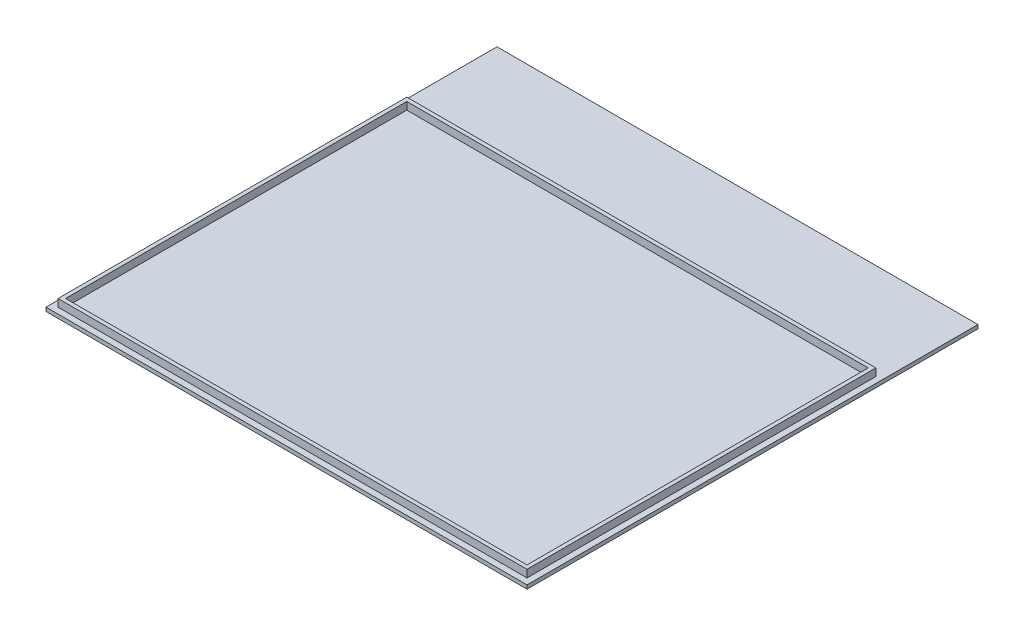
from build123d import *

# Parameters (mm, degrees)
SKETCH1_W           = 203.2
SKETCH1_H           = 152.4
BOSS_EXTRUDE1_DEPTH = 1.5875
SKETCH2_W           = 198.12
SKETCH2_H           = 147.32
BOSS_EXTRUDE2_DEPTH = 3.175
SKETCH3_W           = 194.945
SKETCH3_H           = 144.145
CUT_EXTRUDE1_DEPTH  = 3.175
CUT_EXTRUDE2_DEPTH  = 1
SKETCH5_W           = 203.2
SKETCH5_H           = 1.5875
BOSS_EXTRUDE3_DEPTH = 38.1


with BuildPart() as part:
    # Sketch1 → Boss-Extrude1 (new body)
    with BuildSketch(Plane(origin=(0, 0, 0), x_dir=(1, 0, 0), z_dir=(0, 1, 0))):
        Rectangle(SKETCH1_W, SKETCH1_H)
    extrude(amount=BOSS_EXTRUDE1_DEPTH)

    # Sketch2 → Boss-Extrude2 (add)
    with BuildSketch(Plane(origin=(0, 1.5875, 0), x_dir=(1, 0, 0), z_dir=(0, 1, 0))):
        Rectangle(SKETCH2_W, SKETCH2_H)
    extrude(amount=BOSS_EXTRUDE2_DEPTH)

    # Sketch3 → Cut-Extrude1 (cut)
    with BuildSketch(Plane(origin=(0, 4.7625, 0), x_dir=(1, 0, 0), z_dir=(0, 1, 0))):
        Rectangle(SKETCH3_W, SKETCH3_H)
    extrude(amount=-CUT_EXTRUDE1_DEPTH, mode=Mode.SUBTRACT)

    # Sketch4 → Cut-Extrude2 (cut)
    # profile 1 of 4: a face of its own
    with BuildSketch(Plane.XZ):
        with BuildLine():
            add(Edge.make_bspline(
                [(87.687482338, 63.393037778), (87.544180498, 63.395163571), (87.263013138, 63.399334512), (86.84989298, 63.445259615), (86.45295191, 63.513943675), (86.071785642, 63.613073858), (85.707328729, 63.739904028), (85.358663787, 63.894478976), (85.026714987, 64.077735967), (84.819502101, 64.221838495), (84.715938102, 64.293860243)],
                knots=[0, 0, 0, 0, 1.088390203, 2.135491061, 3.15432687, 4.147127431, 5.124375443, 6.083234765, 7.042009994, 8, 8, 8, 8], degree=3))
            Line((84.715938102, 64.293860243), (85.464673658, 65.438690278))
            add(Edge.make_bspline(
                [(85.464673658, 65.438690278), (85.554129235, 65.383779068), (85.729839827, 65.275921275), (86.0022416, 65.141405914), (86.269211444, 65.019456431), (86.5373257, 64.92608441), (86.802203373, 64.847980095), (87.067243759, 64.798543289), (87.329911742, 64.761631888), (87.505183503, 64.758407341), (87.592219109, 64.756806111)],
                knots=[0, 0, 0, 0, 1.112230725, 2.18466781, 3.218564131, 4.22177194, 5.192100735, 6.143110344, 7.077914681, 8, 8, 8, 8], degree=3))
            add(Edge.make_bspline(
                [(87.592219109, 64.756806111), (87.697613451, 64.759395499), (87.896854582, 64.764290567), (88.178572336, 64.799717186), (88.42449593, 64.862039668), (88.604169312, 64.936871401), (88.727273414, 65.010034381), (88.805391127, 65.071283275), (88.871331447, 65.138994832), (88.926664421, 65.211890197), (88.967710716, 65.292534919), (88.999004768, 65.378783494), (89.014977344, 65.472095466), (89.017961989, 65.536132114), (89.019496262, 65.569050486)],
                knots=[0, 0, 0, 0, 2.06787046, 3.909174252, 5.558319651, 7.032428222, 7.709199981, 8.363072352, 8.973760797, 9.559683912, 10.151289823, 10.742491631, 11.353571293, 12, 12, 12, 12], degree=3))
            add(Edge.make_bspline(
                [(89.019496262, 65.569050486), (89.017622377, 65.608661227), (89.014003312, 65.685162115), (88.993873137, 65.795666295), (88.951830992, 65.893536629), (88.897066826, 65.984399217), (88.820817709, 66.067819866), (88.721118639, 66.146438575), (88.599232863, 66.224002441), (88.451154449, 66.302048242), (88.272555214, 66.384079163), (88.058051044, 66.476150175), (87.80390209, 66.577114485), (87.621248801, 66.647745644), (87.523696435, 66.685468681)],
                knots=[0, 0, 0, 0, 0.716014615, 1.382851049, 2.014298777, 2.628523434, 3.29102057, 4.042009985, 4.915418378, 5.89654535, 7.062180448, 8.463673258, 10.111301242, 12, 12, 12, 12], degree=3))
            Line((87.523696435, 66.685468681), (87.251277026, 66.787417049))
            add(Edge.make_bspline(
                [(87.251277026, 66.787417049), (87.131883376, 66.834314185), (86.903759492, 66.92391993), (86.580736785, 67.059009251), (86.29617949, 67.195795219), (86.042501233, 67.326298061), (85.819856379, 67.469274104), (85.622968416, 67.627772323), (85.451376099, 67.806936723), (85.3017037, 68.003550282), (85.180256671, 68.224848626), (85.098267083, 68.475269787), (85.044889981, 68.750586372), (85.039576486, 68.943662455), (85.036824769, 69.043651424)],
                knots=[0, 0, 0, 0, 1.350270938, 2.579944996, 3.684207822, 4.673163958, 5.580784079, 6.464563274, 7.327195327, 8.185691662, 9.059453378, 9.969967239, 10.948700022, 12, 12, 12, 12], degree=3))
            add(Edge.make_bspline(
                [(85.036824769, 69.043651424), (85.038249081, 69.100512288), (85.041035521, 69.211751506), (85.058779104, 69.375348702), (85.09311133, 69.531042708), (85.137924054, 69.679840443), (85.19449499, 69.822247003), (85.267591385, 69.95551895), (85.35050546, 70.083615146), (85.481597947, 70.241623183), (85.667678901, 70.421457969), (85.921450378, 70.607215342), (86.204485326, 70.761249636), (86.514383232, 70.883665122), (86.843060023, 70.976627693), (87.1842638, 71.04618874), (87.536081533, 71.086680308), (87.774286949, 71.091753044), (87.894721644, 71.094317778)],
                knots=[0, 0, 0, 0, 0.69362378, 1.356964358, 2.003348077, 2.635320559, 3.25108497, 3.868235017, 4.486394243, 5.109352539, 6.368356267, 7.632301231, 8.933825089, 10.287738336, 11.687790791, 13.095030682, 14.531271468, 16, 16, 16, 16], degree=3))
            add(Edge.make_bspline(
                [(87.894721644, 71.094317778), (88.006259639, 71.091718017), (88.231152696, 71.086476142), (88.570775864, 71.044083786), (88.914824666, 70.977461573), (89.262274673, 70.883734273), (89.607726344, 70.76368939), (89.948459614, 70.620024074), (90.28041843, 70.449630953), (90.492246004, 70.317048621), (90.598860324, 70.250318993)],
                knots=[0, 0, 0, 0, 0.932151208, 1.879488113, 2.856754913, 3.859910285, 4.884965218, 5.911679698, 6.948933588, 8, 8, 8, 8], degree=3))
            Line((90.598860324, 70.250318993), (89.828398067, 69.118859236))
            add(Edge.make_bspline(
                [(89.828398067, 69.118859236), (89.736863645, 69.171354537), (89.560602929, 69.272440656), (89.300928116, 69.406854696), (89.055922154, 69.515181578), (88.825041144, 69.606089606), (88.59597996, 69.671567713), (88.363459886, 69.721630556), (88.120923975, 69.747366628), (87.956609669, 69.751728037), (87.872994942, 69.753947431)],
                knots=[0, 0, 0, 0, 1.215398308, 2.340397988, 3.365926346, 4.30024852, 5.195798354, 6.10696021, 7.036687618, 8, 8, 8, 8], degree=3))
            add(Edge.make_bspline(
                [(87.872994942, 69.753947431), (87.783747849, 69.751853869), (87.616243732, 69.74792455), (87.381441466, 69.715432252), (87.18091247, 69.660373407), (87.014612893, 69.582082155), (86.885488795, 69.482907736), (86.789387504, 69.36766599), (86.733721308, 69.232611289), (86.726707171, 69.137166124), (86.723151053, 69.088776111)],
                knots=[0, 0, 0, 0, 1.44704339, 2.715894902, 3.834130185, 4.808024926, 5.67734852, 6.454863682, 7.21662698, 8, 8, 8, 8], degree=3))
            add(Edge.make_bspline(
                [(86.723151053, 69.088776111), (86.723957289, 69.057358759), (86.725536859, 68.995806109), (86.752496518, 68.907193505), (86.785387259, 68.820886562), (86.839920663, 68.740419421), (86.913185662, 68.663427859), (87.00719413, 68.586615481), (87.126317151, 68.512535274), (87.268429358, 68.433969562), (87.441266172, 68.356968011), (87.644304397, 68.270878405), (87.881065662, 68.180105556), (88.050605635, 68.118587563), (88.140400498, 68.086005278)],
                knots=[0, 0, 0, 0, 0.611448345, 1.197945174, 1.798629464, 2.41182121, 3.08221344, 3.871489678, 4.777799232, 5.820833777, 7.043972926, 8.474053442, 10.13252367, 12, 12, 12, 12], degree=3))
            Line((88.140400498, 68.086005278), (88.397778345, 67.994084618))
            add(Edge.make_bspline(
                [(88.397778345, 67.994084618), (88.517286574, 67.95027093), (88.745200142, 67.866714055), (89.066269019, 67.735597032), (89.352348184, 67.611214996), (89.607124872, 67.488662986), (89.836746498, 67.355715658), (90.041440179, 67.195035642), (90.227632837, 67.00961678), (90.36799137, 66.836923936), (90.465471519, 66.683821559), (90.531605687, 66.560484384), (90.583590939, 66.427402892), (90.630673299, 66.288038855), (90.662116386, 66.139171116), (90.688136917, 65.982608434), (90.702978045, 65.817799953), (90.704863096, 65.705009025), (90.705822546, 65.647600868)],
                knots=[0, 0, 0, 0, 1.708232228, 3.257761454, 4.653902717, 5.894501656, 7.051145496, 8.207281712, 9.375731413, 10.572637944, 11.184521031, 11.809958992, 12.447262207, 13.099864783, 13.781914544, 14.486263721, 15.229540774, 16, 16, 16, 16], degree=3))
            add(Edge.make_bspline(
                [(90.705822546, 65.647600868), (90.704489972, 65.586826292), (90.701879719, 65.467780736), (90.682812927, 65.292990905), (90.65358831, 65.125644361), (90.609985263, 64.965576294), (90.552134869, 64.813755044), (90.486347381, 64.667268787), (90.405082686, 64.529321702), (90.280001229, 64.356315368), (90.098562066, 64.156446709), (89.843787917, 63.949382319), (89.552301029, 63.776846575), (89.228746552, 63.63553157), (88.876577474, 63.525913575), (88.499394491, 63.451174145), (88.101127592, 63.400060051), (87.827482438, 63.395414498), (87.687482338, 63.393037778)],
                knots=[0, 0, 0, 0, 0.688067677, 1.347790536, 1.988758647, 2.610086294, 3.222901317, 3.826952045, 4.426340263, 5.032068593, 6.242292804, 7.470873953, 8.7355743, 10.065923099, 11.460571383, 12.90311865, 14.415598835, 16, 16, 16, 16], degree=3))
        make_face()
    # profile 2 of 4: a face of its own
    with BuildSketch(Plane.XZ):
        with BuildLine():
            add(Edge.make_bspline(
                [(81.242674192, 63.393037778), (81.091004345, 63.396118206), (80.797984944, 63.402069457), (80.374138197, 63.451279504), (79.981721088, 63.53035604), (79.619554814, 63.641404857), (79.289453473, 63.787919073), (78.989737963, 63.964771377), (78.722128954, 64.176211973), (78.488161537, 64.420123293), (78.284115012, 64.690524015), (78.108409448, 64.983782264), (77.956779052, 65.297011879), (77.835534999, 65.633423328), (77.739537298, 65.990549748), (77.674642706, 66.370521805), (77.63098408, 66.771358686), (77.626588692, 67.046344079), (77.624342769, 67.186854097)],
                knots=[0, 0, 0, 0, 1.215224145, 2.347759012, 3.414257053, 4.419701573, 5.377121085, 6.302083392, 7.201577565, 8.101470548, 9.003354937, 9.91070414, 10.837270593, 11.78783653, 12.772284399, 13.796993452, 14.874323882, 16, 16, 16, 16], degree=3))
            add(Edge.make_bspline(
                [(77.624342769, 67.186854097), (77.62619306, 67.301084614), (77.629797765, 67.523626429), (77.650701787, 67.849581855), (77.689979039, 68.158406837), (77.740270573, 68.451872261), (77.809025935, 68.728194516), (77.892951049, 68.987534979), (77.988695422, 69.231699721), (78.103906794, 69.457165595), (78.228886718, 69.668654923), (78.365864048, 69.863731642), (78.512442088, 70.043867207), (78.66709934, 70.20992106), (78.833767571, 70.359018485), (79.009142736, 70.493633246), (79.196296815, 70.610598933), (79.391928369, 70.714152433), (79.595834837, 70.804535031), (79.807080406, 70.880205736), (80.022805177, 70.948555099), (80.245872891, 71.001289835), (80.475146656, 71.043095196), (80.710515916, 71.073482703), (80.952200007, 71.089674893), (81.115077983, 71.092757124), (81.197549505, 71.094317778)],
                knots=[0, 0, 0, 0, 1.363633423, 2.656605835, 3.896307075, 5.078155968, 6.208755071, 7.291789676, 8.330301951, 9.335492128, 10.310580477, 11.260677713, 12.177736252, 13.080996344, 13.966256674, 14.844067698, 15.716725188, 16.597252343, 17.484458686, 18.376437129, 19.274566624, 20.184241805, 21.110321438, 22.055565732, 23.015456493, 24, 24, 24, 24], degree=3))
            add(Edge.make_bspline(
                [(81.197549505, 71.094317778), (81.312382641, 71.092561982), (81.538049382, 71.089111544), (81.868757633, 71.056995948), (82.184729666, 71.00325401), (82.488708363, 70.929384938), (82.785409388, 70.832582918), (83.079911054, 70.714935299), (83.375431659, 70.576823462), (83.567025758, 70.467815471), (83.664365755, 70.412433611)],
                knots=[0, 0, 0, 0, 1.063018505, 2.089013054, 3.07268249, 4.028476531, 4.982724396, 5.95971745, 6.963427908, 8, 8, 8, 8], degree=3))
            Line((83.664365755, 70.412433611), (83.051004262, 69.199080903))
            add(Edge.make_bspline(
                [(83.051004262, 69.199080903), (82.982607869, 69.242061453), (82.847090623, 69.327220999), (82.632947298, 69.433192665), (82.416164428, 69.525579608), (82.195222279, 69.601525305), (81.969108655, 69.658045693), (81.739167614, 69.699878812), (81.504542494, 69.725772622), (81.346915462, 69.728952349), (81.267743463, 69.730549444)],
                knots=[0, 0, 0, 0, 1.026753925, 2.034359703, 3.03446459, 4.022551219, 5.00203997, 5.995699322, 6.993291378, 8, 8, 8, 8], degree=3))
            add(Edge.make_bspline(
                [(81.267743463, 69.730549444), (81.188548216, 69.728615021), (81.035193009, 69.724869166), (80.812322793, 69.696220044), (80.605001021, 69.648339536), (80.412373286, 69.580701606), (80.234121954, 69.496208366), (80.071962084, 69.390135844), (79.927407231, 69.26265278), (79.796358988, 69.118355595), (79.679757038, 68.955087443), (79.581880157, 68.770499242), (79.496147937, 68.568420351), (79.428527208, 68.346332528), (79.375164989, 68.106066661), (79.336947752, 67.846942091), (79.316000971, 67.568253204), (79.312485676, 67.376300306), (79.310669053, 67.277103472)],
                knots=[0, 0, 0, 0, 1.05947598, 2.051589783, 3.00088368, 3.901484541, 4.778356941, 5.634320937, 6.484944874, 7.35043153, 8.237792567, 9.161723082, 10.140557543, 11.17091745, 12.263267399, 13.431358072, 14.672585054, 16, 16, 16, 16], degree=3))
            add(Edge.make_bspline(
                [(79.310669053, 67.277103472), (79.312234244, 67.17845232), (79.315272746, 66.986940965), (79.339804834, 66.708615371), (79.383964791, 66.449207879), (79.440829025, 66.206965186), (79.518669757, 65.983517451), (79.61122385, 65.777339871), (79.722420265, 65.59019509), (79.849968955, 65.421696611), (79.993984008, 65.27284135), (80.152080106, 65.143248873), (80.324350689, 65.032646888), (80.512353175, 64.945737104), (80.712580937, 64.873382035), (80.927921621, 64.827021616), (81.156498021, 64.795341595), (81.31386511, 64.791966701), (81.394761102, 64.790231806)],
                knots=[0, 0, 0, 0, 1.282188633, 2.489111131, 3.627164722, 4.700243241, 5.719287083, 6.69790978, 7.633023459, 8.542525953, 9.438699874, 10.318577291, 11.19439307, 12.091619526, 13.005406927, 13.955760169, 14.949139811, 16, 16, 16, 16], degree=3))
            add(Edge.make_bspline(
                [(81.394761102, 64.790231806), (81.477291871, 64.791662505), (81.637186133, 64.794434327), (81.868339218, 64.820644544), (82.084265979, 64.858920627), (82.28645656, 64.919838536), (82.482564761, 64.99531676), (82.680810389, 65.082420695), (82.882130743, 65.184530012), (83.016181255, 65.259919537), (83.084429956, 65.298302361)],
                knots=[0, 0, 0, 0, 1.106931204, 2.144557108, 3.118030623, 4.045232027, 4.972614202, 5.936512524, 6.949423339, 8, 8, 8, 8], degree=3))
            Line((83.084429956, 65.298302361), (83.721189435, 64.143444618))
            add(Edge.make_bspline(
                [(83.721189435, 64.143444618), (83.618794326, 64.084273501), (83.418006162, 63.968243937), (83.110977681, 63.818323571), (82.808231003, 63.688964919), (82.507409255, 63.580598113), (82.203435282, 63.494812849), (81.891095276, 63.438096281), (81.570120462, 63.39899086), (81.352541563, 63.395035203), (81.242674192, 63.393037778)],
                knots=[0, 0, 0, 0, 1.081820934, 2.121359505, 3.124012681, 4.093020802, 5.045299528, 6.010061601, 6.995172318, 8, 8, 8, 8], degree=3))
        make_face()
    # profile 3 of 4: a face of its own
    with BuildSketch(Plane.XZ):
        Polygon((74.072528477, 70.987355556), (75.666934102, 70.987355556), (75.666934102, 63.5), (74.072528477, 63.5), (74.072528477, 66.606918299), (70.629681949, 66.606918299), (70.629681949, 63.5), (69.035276324, 63.5), (69.035276324, 70.987355556), (70.629681949, 70.987355556), (70.629681949, 67.992413333), (74.072528477, 67.992413333), align=None)
    # profile 4 of 4: a face of its own
    with BuildSketch(Plane.XZ):
        Polygon((64.68625922, 70.987355556), (67.398754324, 63.59192066), (67.398754324, 63.5), (65.640562796, 63.5), (65.035557727, 65.284932083), (62.239498387, 65.284932083), (61.64619231, 63.5), (59.911398769, 63.5), (59.911398769, 63.59192066), (62.623893873, 70.987355556), align=None)
        Polygon((62.692416546, 66.601904444), (64.617736546, 66.601904444), (63.643377553, 69.459801319), align=None, mode=Mode.SUBTRACT)
    extrude(amount=-CUT_EXTRUDE2_DEPTH, mode=Mode.SUBTRACT)

    # Sketch5 → Boss-Extrude3 (add)
    with BuildSketch(Plane(origin=(0, 0, -76.2), x_dir=(-1, 0, 0), z_dir=(0, 0, -1))):
        with Locations((0, 0.79375)):
            Rectangle(SKETCH5_W, SKETCH5_H)
    extrude(amount=BOSS_EXTRUDE3_DEPTH)


solid = part.part
